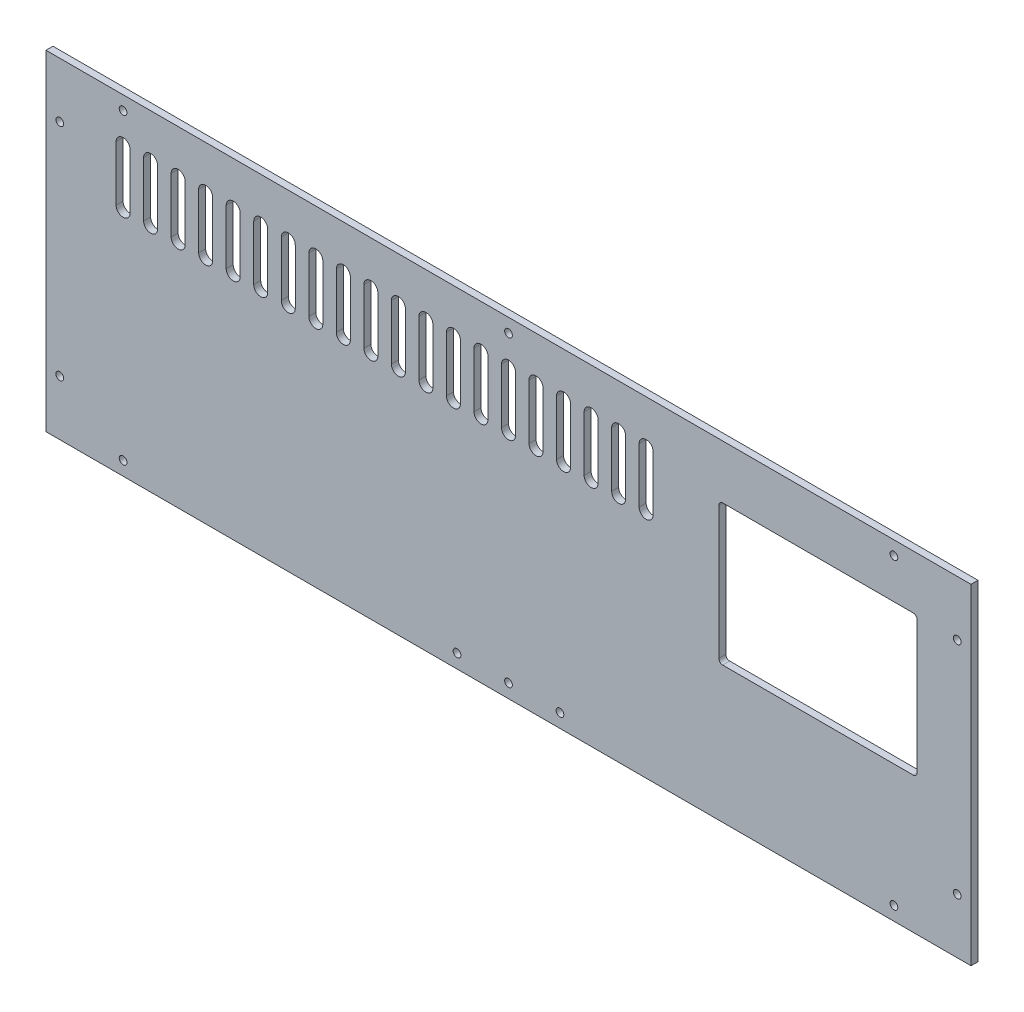
from build123d import *

# Parameters (mm, degrees)
SKETCH2_W           = 840
SKETCH2_H           = 300
BOSS_EXTRUDE1_DEPTH = 6.35
CUT_EXTRUDE1_DEPTH  = 6.35
SKETCH4_R           = 3.5
CUT_EXTRUDE2_DEPTH  = 892.98672776
SKETCH5_W           = 180
SKETCH5_H           = 127.5
CUT_EXTRUDE3_DEPTH  = 892.98672776
FILLET1_R           = 3.5


with BuildPart() as part:
    # Sketch2 → Boss-Extrude1 (new body)
    with BuildSketch(Plane.XY):
        with Locations((420, 150)):
            Rectangle(SKETCH2_W, SKETCH2_H)
    extrude(amount=BOSS_EXTRUDE1_DEPTH)

    # Sketch3 → Cut-Extrude1 (cut)
    with BuildSketch(Plane.XY.offset(6.35)):
        with BuildLine():
            Line((413.65, 210), (413.65, 260))
            ThreePointArc((413.65, 260), (420, 266.35), (426.35, 260))
            Line((426.35, 260), (426.35, 210))
            ThreePointArc((426.35, 210), (420, 203.65), (413.65, 210))
        make_face()
        with BuildLine():
            Line((451.35, 210), (451.35, 260))
            ThreePointArc((451.35, 260), (445, 266.35), (438.65, 260))
            Line((438.65, 260), (438.65, 210))
            ThreePointArc((438.65, 210), (445, 203.65), (451.35, 210))
        make_face()
        with BuildLine():
            Line((476.35, 210), (476.35, 260))
            ThreePointArc((476.35, 260), (470, 266.35), (463.65, 260))
            Line((463.65, 260), (463.65, 210))
            ThreePointArc((463.65, 210), (470, 203.65), (476.35, 210))
        make_face()
        with BuildLine():
            Line((501.35, 210), (501.35, 260))
            ThreePointArc((501.35, 260), (495, 266.35), (488.65, 260))
            Line((488.65, 260), (488.65, 210))
            ThreePointArc((488.65, 210), (495, 203.65), (501.35, 210))
        make_face()
        with BuildLine():
            Line((401.35, 210), (401.35, 260))
            ThreePointArc((401.35, 260), (395, 266.35), (388.65, 260))
            Line((388.65, 260), (388.65, 210))
            ThreePointArc((388.65, 210), (395, 203.65), (401.35, 210))
        make_face()
        with BuildLine():
            Line((376.35, 210), (376.35, 260))
            ThreePointArc((376.35, 260), (370, 266.35), (363.65, 260))
            Line((363.65, 260), (363.65, 210))
            ThreePointArc((363.65, 210), (370, 203.65), (376.35, 210))
        make_face()
        with BuildLine():
            Line((351.35, 210), (351.35, 260))
            ThreePointArc((351.35, 260), (345, 266.35), (338.65, 260))
            Line((338.65, 260), (338.65, 210))
            ThreePointArc((338.65, 210), (345, 203.65), (351.35, 210))
        make_face()
        with BuildLine():
            Line((326.35, 210), (326.35, 260))
            ThreePointArc((326.35, 260), (320, 266.35), (313.65, 260))
            Line((313.65, 260), (313.65, 210))
            ThreePointArc((313.65, 210), (320, 203.65), (326.35, 210))
        make_face()
        with BuildLine():
            Line((301.35, 210), (301.35, 260))
            ThreePointArc((301.35, 260), (295, 266.35), (288.65, 260))
            Line((288.65, 260), (288.65, 210))
            ThreePointArc((288.65, 210), (295, 203.65), (301.35, 210))
        make_face()
        with BuildLine():
            Line((276.35, 210), (276.35, 260))
            ThreePointArc((276.35, 260), (270, 266.35), (263.65, 260))
            Line((263.65, 260), (263.65, 210))
            ThreePointArc((263.65, 210), (270, 203.65), (276.35, 210))
        make_face()
        with BuildLine():
            Line((251.35, 210), (251.35, 260))
            ThreePointArc((251.35, 260), (245, 266.35), (238.65, 260))
            Line((238.65, 260), (238.65, 210))
            ThreePointArc((238.65, 210), (245, 203.65), (251.35, 210))
        make_face()
        with BuildLine():
            Line((226.35, 210), (226.35, 260))
            ThreePointArc((226.35, 260), (220, 266.35), (213.65, 260))
            Line((213.65, 260), (213.65, 210))
            ThreePointArc((213.65, 210), (220, 203.65), (226.35, 210))
        make_face()
        with BuildLine():
            Line((201.35, 210), (201.35, 260))
            ThreePointArc((201.35, 260), (195, 266.35), (188.65, 260))
            Line((188.65, 260), (188.65, 210))
            ThreePointArc((188.65, 210), (195, 203.65), (201.35, 210))
        make_face()
        with BuildLine():
            Line((176.35, 210), (176.35, 260))
            ThreePointArc((176.35, 260), (170, 266.35), (163.65, 260))
            Line((163.65, 260), (163.65, 210))
            ThreePointArc((163.65, 210), (170, 203.65), (176.35, 210))
        make_face()
        with BuildLine():
            Line((151.35, 210), (151.35, 260))
            ThreePointArc((151.35, 260), (145, 266.35), (138.65, 260))
            Line((138.65, 260), (138.65, 210))
            ThreePointArc((138.65, 210), (145, 203.65), (151.35, 210))
        make_face()
        with BuildLine():
            Line((126.35, 210), (126.35, 260))
            ThreePointArc((126.35, 260), (120, 266.35), (113.65, 260))
            Line((113.65, 260), (113.65, 210))
            ThreePointArc((113.65, 210), (120, 203.65), (126.35, 210))
        make_face()
        with BuildLine():
            Line((101.35, 210), (101.35, 260))
            ThreePointArc((101.35, 260), (95, 266.35), (88.65, 260))
            Line((88.65, 260), (88.65, 210))
            ThreePointArc((88.65, 210), (95, 203.65), (101.35, 210))
        make_face()
        with BuildLine():
            Line((76.35, 210), (76.35, 260))
            ThreePointArc((76.35, 260), (70, 266.35), (63.65, 260))
            Line((63.65, 260), (63.65, 210))
            ThreePointArc((63.65, 210), (70, 203.65), (76.35, 210))
        make_face()
        with BuildLine():
            Line((526.35, 210), (526.35, 260))
            ThreePointArc((526.35, 260), (520, 266.35), (513.65, 260))
            Line((513.65, 260), (513.65, 210))
            ThreePointArc((513.65, 210), (520, 203.65), (526.35, 210))
        make_face()
        with BuildLine():
            Line((551.35, 210), (551.35, 260))
            ThreePointArc((551.35, 260), (545, 266.35), (538.65, 260))
            Line((538.65, 260), (538.65, 210))
            ThreePointArc((538.65, 210), (545, 203.65), (551.35, 210))
        make_face()
    extrude(amount=-CUT_EXTRUDE1_DEPTH, mode=Mode.SUBTRACT)

    # Sketch4 → Cut-Extrude2 (cut, through all)
    with BuildSketch(Plane.XY.offset(6.35)):
        with Locations((420, 287.5)):
            Circle(SKETCH4_R)
        with Locations((770, 287.5)):
            Circle(SKETCH4_R)
        with Locations((70, 287.5)):
            Circle(SKETCH4_R)
        with Locations((12.5, 250)):
            Circle(SKETCH4_R)
        with Locations((12.5, 50)):
            Circle(SKETCH4_R)
        with Locations(Location((827.5, 50, 0), (0, 0, 180))):
            Circle(SKETCH4_R)
        with Locations(Location((827.5, 250, 0), (0, 0, 180))):
            Circle(SKETCH4_R)
        with Locations(Location((770, 12.5, 0), (0, 0, 180))):
            Circle(SKETCH4_R)
        with Locations(Location((420, 12.5, 0), (0, 0, 180))):
            Circle(SKETCH4_R)
        with Locations(Location((70, 12.5, 0), (0, 0, 180))):
            Circle(SKETCH4_R)
        with Locations((373.25, 12.5)):
            Circle(SKETCH4_R)
        with Locations((466.75, 12.5)):
            Circle(SKETCH4_R)
    extrude(amount=-CUT_EXTRUDE2_DEPTH, mode=Mode.SUBTRACT)

    # Sketch5 → Cut-Extrude3 (cut, through all)
    with BuildSketch(Plane.XY.offset(6.35)):
        with Locations((701, 187.5)):
            Rectangle(SKETCH5_W, SKETCH5_H)
    extrude(amount=-CUT_EXTRUDE3_DEPTH, mode=Mode.SUBTRACT)

    # Fillet1
    fillet1_edges = [part.edges().sort_by_distance(p)[0] for p in [
        (611, 123.75, 3.175),
        (611, 251.25, 3.175),
        (791, 251.25, 3.175),
        (791, 123.75, 3.175),
    ]]
    fillet(fillet1_edges, radius=FILLET1_R)


solid = part.part
